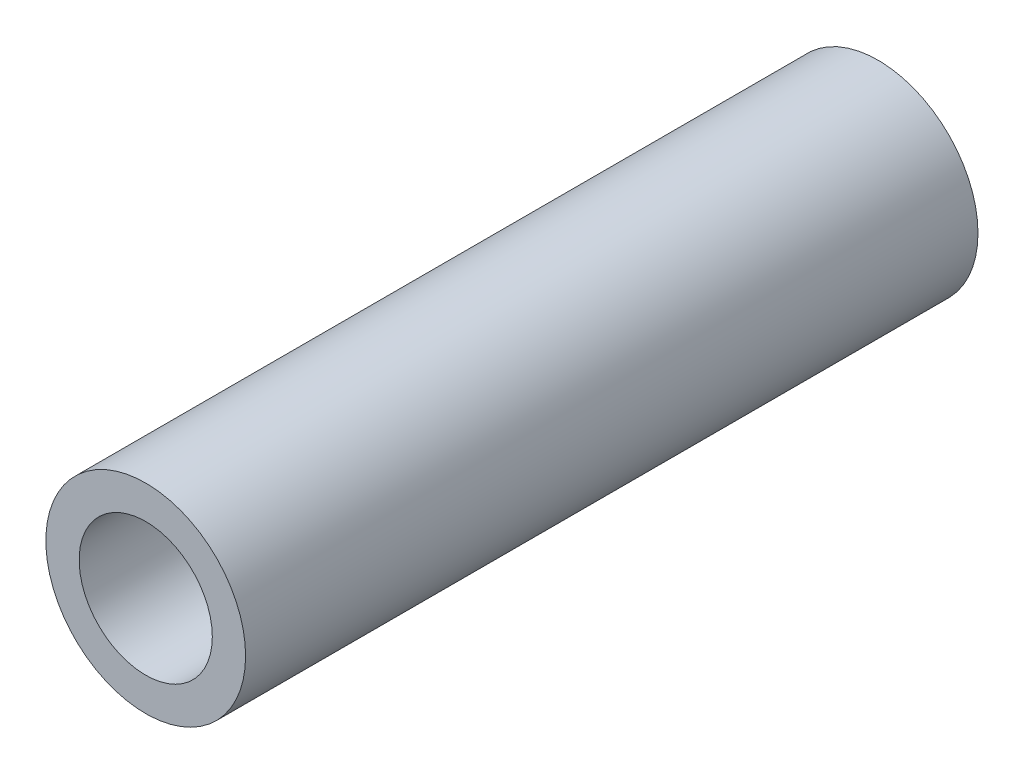
from build123d import *

# Parameters (mm, degrees)
SKETCH1_R           = 37.5
SKETCH1_R_2         = 25
BOSS_EXTRUDE1_DEPTH = 275


with BuildPart() as part:
    # Sketch1 → Boss-Extrude1 (new body)
    with BuildSketch(Plane.XY):
        Circle(SKETCH1_R)
        Circle(SKETCH1_R_2, mode=Mode.SUBTRACT)
    extrude(amount=BOSS_EXTRUDE1_DEPTH)


solid = part.part
